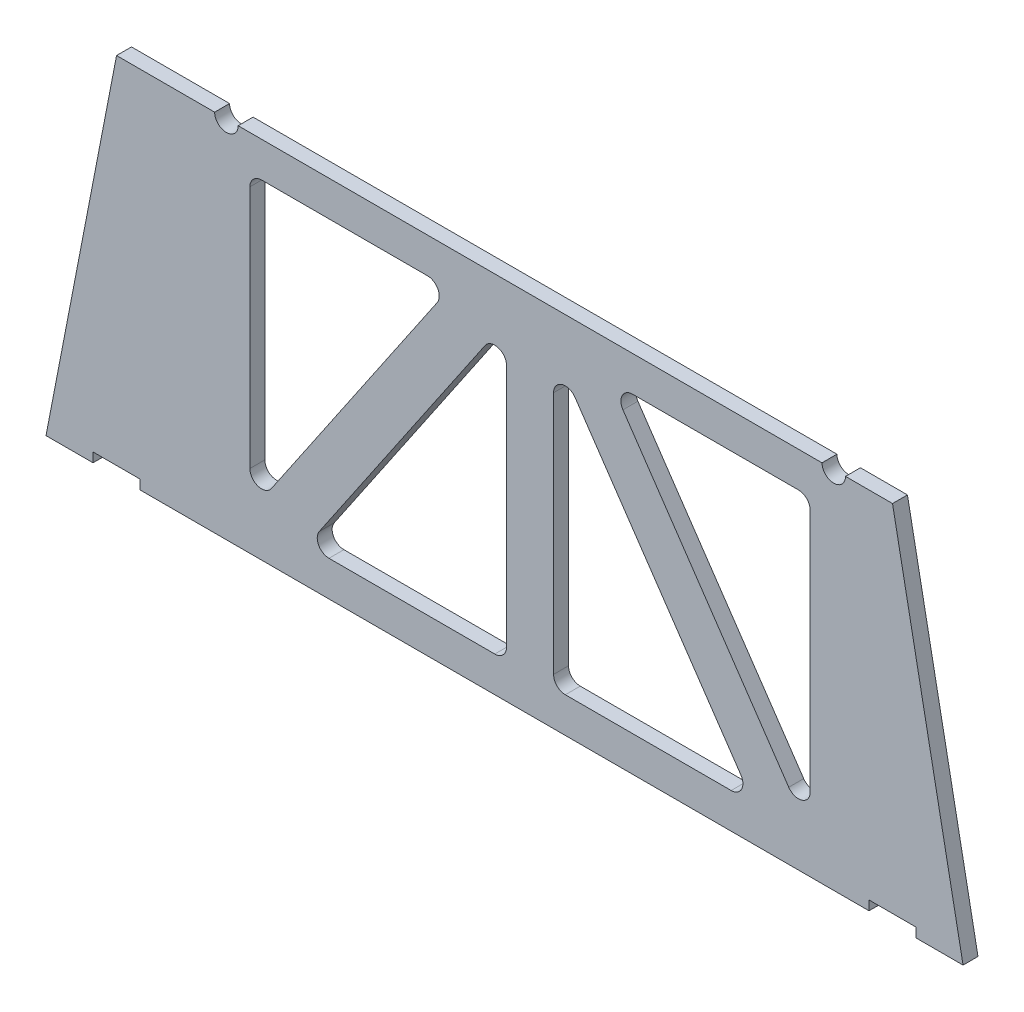
from build123d import *

# Parameters (mm, degrees)
EXTRUDE1_DEPTH = 6.35


with BuildPart() as part:
    # Sketch1 → Extrude1 (new body)
    with BuildSketch(Plane.XY):
        with BuildLine():
            Line((-165.85625, -77.5), (144.14375, -77.5))
            Line((144.14375, -77.5), (144.14375, -73.5))
            Line((144.14375, -73.5), (164.14375, -73.5))
            Line((164.14375, -73.5), (164.14375, -77.5))
            Line((164.14375, -77.5), (184.14375, -77.5))
            Line((184.14375, -77.5), (154.14375, 77.5))
            Line((154.14375, 77.5), (134.14375, 77.5))
            ThreePointArc((134.14375, 77.5), (129.14375, 72.5), (124.14375, 77.5))
            Line((124.14375, 77.5), (-124.14375, 77.5))
            ThreePointArc((-124.14375, 77.5), (-129.14375, 72.5), (-134.14375, 77.5))
            Line((-134.14375, 77.5), (-175.85625, 77.5))
            Line((-175.85625, 77.5), (-205.85625, -77.5))
            Line((-205.85625, -77.5), (-185.85625, -77.5))
            Line((-185.85625, -77.5), (-185.85625, -73.5))
            Line((-185.85625, -73.5), (-165.85625, -73.5))
            Line((-165.85625, -73.5), (-165.85625, -77.5))
        make_face()
        with BuildLine():
            Line((-119.14375, 57.5), (-119.14375, -46.249045525))
            ThreePointArc((-119.14375, -46.249045525), (-115.614100349, -51.027964843), (-110.00852206, -49.059719801))
            Line((-110.00852206, -49.059719801), (-39.491303269, 54.689325724))
            ThreePointArc((-39.491303269, 54.689325724), (-39.207630249, 59.839511554), (-43.626531209, 62.5))
            Line((-43.626531209, 62.5), (-114.14375, 62.5))
            ThreePointArc((-114.14375, 62.5), (-117.679283906, 61.035533906), (-119.14375, 57.5))
        make_face(mode=Mode.SUBTRACT)
        with BuildLine():
            Line((-89.652446731, -54.689325724), (-19.13522794, 49.059719801))
            ThreePointArc((-19.13522794, 49.059719801), (-13.529649651, 51.027964843), (-10, 46.249045525))
            Line((-10, 46.249045525), (-10, -57.5))
            ThreePointArc((-10, -57.5), (-11.464466094, -61.035533906), (-15, -62.5))
            Line((-15, -62.5), (-85.517218791, -62.5))
            ThreePointArc((-85.517218791, -62.5), (-89.936119751, -59.839511554), (-89.652446731, -54.689325724))
        make_face(mode=Mode.SUBTRACT)
        with BuildLine():
            Line((15, -62.5), (85.517218791, -62.5))
            ThreePointArc((85.517218791, -62.5), (89.936119751, -59.839511554), (89.652446731, -54.689325724))
            Line((89.652446731, -54.689325724), (19.13522794, 49.059719801))
            ThreePointArc((19.13522794, 49.059719801), (13.529649651, 51.027964843), (10, 46.249045525))
            Line((10, 46.249045525), (10, -57.5))
            ThreePointArc((10, -57.5), (11.464466094, -61.035533906), (15, -62.5))
        make_face(mode=Mode.SUBTRACT)
        with BuildLine():
            Line((43.626531209, 62.5), (114.14375, 62.5))
            ThreePointArc((114.14375, 62.5), (117.679283906, 61.035533906), (119.14375, 57.5))
            Line((119.14375, 57.5), (119.14375, -46.249045525))
            ThreePointArc((119.14375, -46.249045525), (115.614100349, -51.027964843), (110.00852206, -49.059719801))
            Line((110.00852206, -49.059719801), (39.491303269, 54.689325724))
            ThreePointArc((39.491303269, 54.689325724), (39.207630249, 59.839511554), (43.626531209, 62.5))
        make_face(mode=Mode.SUBTRACT)
    extrude(amount=EXTRUDE1_DEPTH)


solid = part.part
